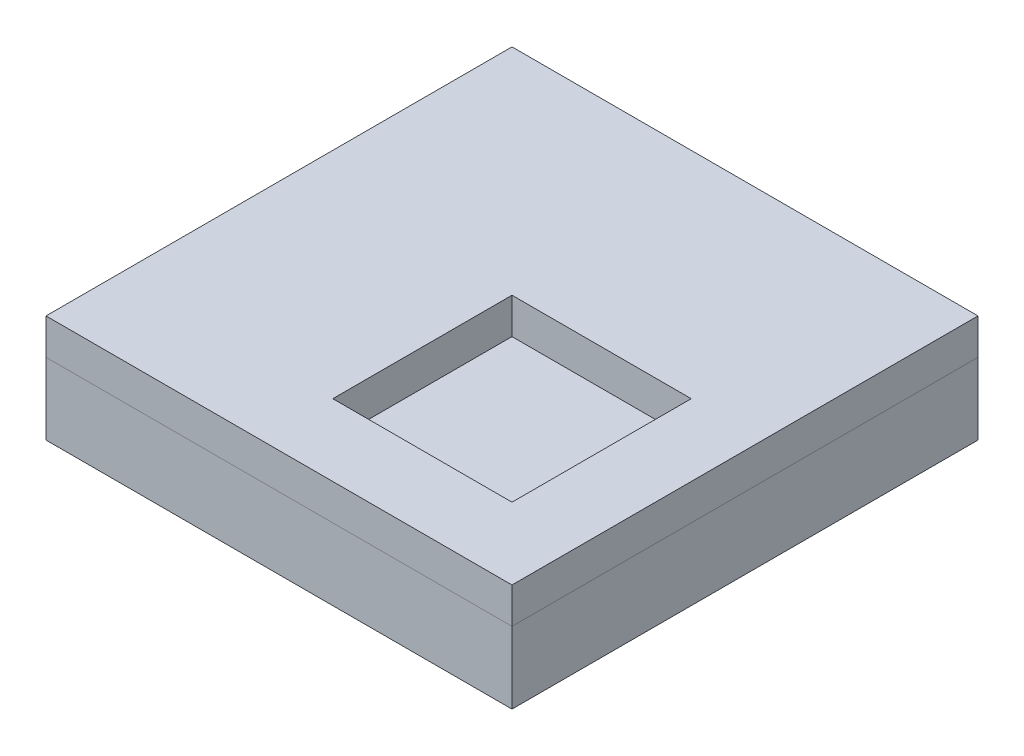
from build123d import *

# Parameters (mm, degrees)
SKETCH_1_W          = 13
SKETCH_1_H          = 13
EXTRUDE_1_DEPTH     = 2
CUT_EXTRUDE_START   = 1
SKETCH_2_W          = 11
SKETCH_2_H          = 15
CUT_EXTRUDE_1_DEPTH = 3
EXTRUDE_START       = 2
SKETCH_3_W          = 13
SKETCH_3_H          = 13
EXTRUDE_3_DEPTH     = 1
CUT_EXTRUDE_START_2 = 3
SKETCH_4_W          = 5
SKETCH_4_H          = 5
CUT_EXTRUDE_2_DEPTH = 1


with BuildPart() as part:
    # 스케치1 → 보스-돌출1 (new body)
    with BuildSketch(Plane(origin=(0, 0, 0), x_dir=(1, 0, 0), z_dir=(0, 1, 0))):
        Rectangle(SKETCH_1_W, SKETCH_1_H)
    extrude(amount=EXTRUDE_1_DEPTH)

    # 스케치2 → 컷-돌출1 (cut)
    with BuildSketch(Plane(origin=(0, 0, 0), x_dir=(1, 0, 0), z_dir=(0, 1, 0)).offset(CUT_EXTRUDE_START)):
        with Locations((0, 2)):
            Rectangle(SKETCH_2_W, SKETCH_2_H)
    extrude(amount=CUT_EXTRUDE_1_DEPTH, mode=Mode.SUBTRACT)


with BuildPart() as body_2:
    # 스케치3 → 보스-돌출3 (new body)
    with BuildSketch(Plane(origin=(0, 0, 0), x_dir=(1, 0, 0), z_dir=(0, 1, 0)).offset(EXTRUDE_START)):
        Rectangle(SKETCH_3_W, SKETCH_3_H)
    extrude(amount=EXTRUDE_3_DEPTH)

    # 스케치4 → 컷-돌출2 (cut)
    with BuildSketch(Plane(origin=(0, 0, 0), x_dir=(1, 0, 0), z_dir=(0, 1, 0)).offset(CUT_EXTRUDE_START_2)):
        with Locations((2, -2)):
            Rectangle(SKETCH_4_W, SKETCH_4_H)
    extrude(amount=-CUT_EXTRUDE_2_DEPTH, mode=Mode.SUBTRACT)


solid = Compound([part.part, body_2.part])
